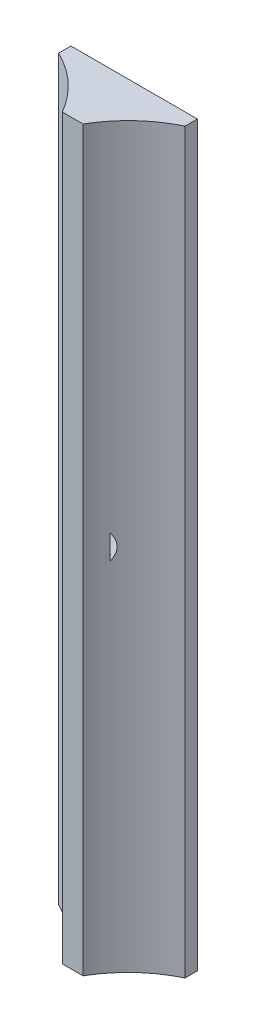
from build123d import *

# Parameters (mm, degrees)
BOSS_EXTRUDE1_DEPTH = 30


with BuildPart() as part:
    # Sketch1 → Boss-Extrude1 (new, symmetric)
    with BuildSketch(Plane(origin=(0, 0, 0), x_dir=(1, 0, 0), z_dir=(0, 1, 0))):
        with BuildLine():
            Line((-0.839745962, 0), (0.839745962, 0))
            ThreePointArc((0.839745962, 0), (2.690111154, 2.322937519), (5.141101056, 4))
            Line((5.141101056, 4), (5.141101056, 5))
            Line((5.141101056, 5), (-5.141101056, 5))
            Line((-5.141101056, 5), (-5.141101056, 4))
            ThreePointArc((-5.141101056, 4), (-2.690111154, 2.322937519), (-0.839745962, 0))
        make_face()
    extrude(amount=BOSS_EXTRUDE1_DEPTH, both=True)

    # Sketch8 → #24 (0.152) Diameter Hole1 (revolve, cut)
    with BuildSketch(Plane(origin=(0, 0, -5), x_dir=(0, 1, 0), z_dir=(1, 0, 0))):
        Polygon((0, 0), (0, 3.7), (1.999999937, 3.7), (1.999999937, 2.860134796), (2.200000045, 0), align=None)
    revolve(axis=Axis((0, 0, -11.35), (0, 0, 1)), mode=Mode.SUBTRACT)


solid = part.part
